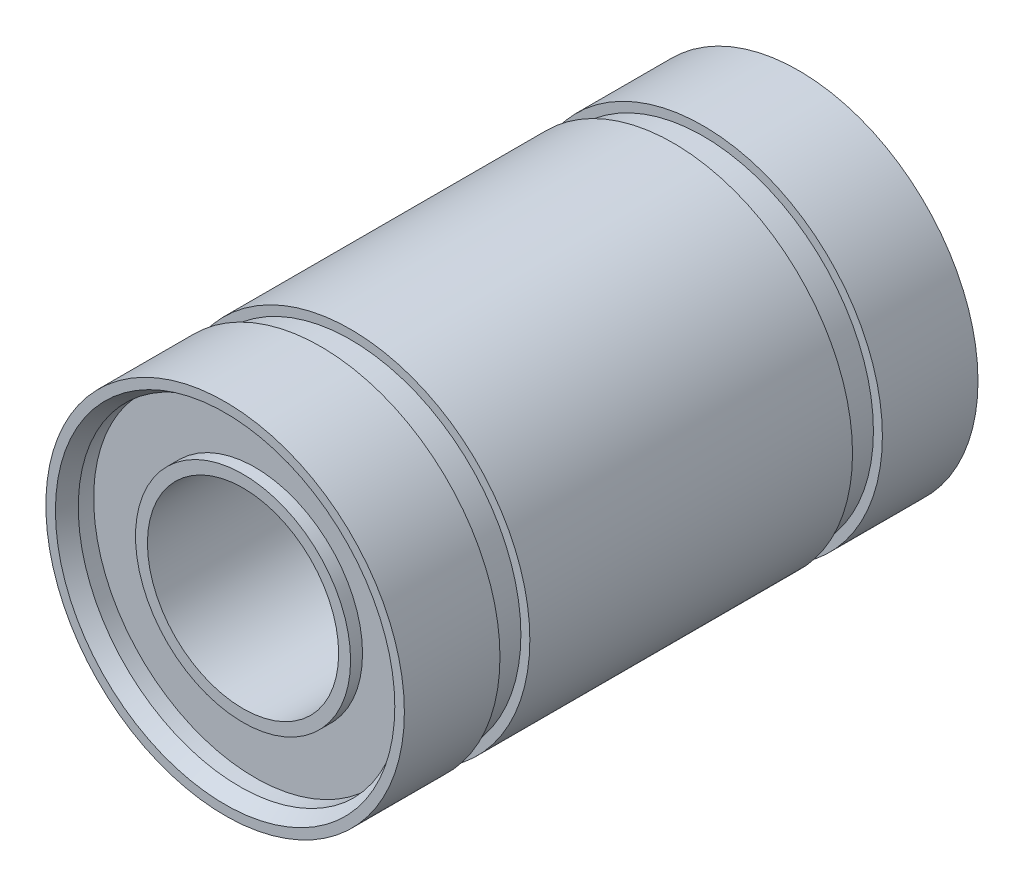
from build123d import *

# Parameters (mm, degrees)
SZKIC1_R                    = 7.5
SZKIC1_R_2                  = 4
DODANIE_WYCI_GNI_CIE1_DEPTH = 12
SZKIC2_R                    = 6.75
WYTNIJ_WYCI_GNI_CIE1_DEPTH  = 1.25
SZKIC3_R                    = 4.5
SZKIC3_R_2                  = 4
DODANIE_WYCI_GNI_CIE2_DEPTH = 0.5
SFAZOWANIE1_SIZE            = 0.35
SFAZOWANIE1_SIZE2           = 0.606217783
SZKIC4_R                    = 7.5
SZKIC4_R_2                  = 7.125
WYTNIJ_WYCI_GNI_CIE2_DEPTH  = 1.25
SFAZOWANIE2_SIZE            = 0.35
SFAZOWANIE2_SIZE2           = 0.606217783


with BuildPart() as part:
    # Szkic1 → Dodanie-wyciągnięcie1 (new, symmetric)
    with BuildSketch(Plane.XY):
        Circle(SZKIC1_R)
        Circle(SZKIC1_R_2, mode=Mode.SUBTRACT)
    extrude(amount=DODANIE_WYCI_GNI_CIE1_DEPTH, both=True)

    # Szkic2 → Wytnij-wyciągnięcie1 (cut)
    with BuildSketch(Plane.XY.offset(12)):
        Circle(SZKIC2_R)
    wytnij_wyci_gni_cie1 = extrude(amount=-WYTNIJ_WYCI_GNI_CIE1_DEPTH, mode=Mode.SUBTRACT)

    # Szkic3 → Dodanie-wyciągnięcie2 (add)
    with BuildSketch(Plane.XY.offset(10.75)):
        Circle(SZKIC3_R)
        Circle(SZKIC3_R_2, mode=Mode.SUBTRACT)
    dodanie_wyci_gni_cie2 = extrude(amount=DODANIE_WYCI_GNI_CIE2_DEPTH)

    # Sfazowanie1
    sfazowanie1_edges = [part.edges().sort_by_distance(p)[0] for p in [
        (-6.75, 0, 12),
    ]]
    sfazowanie1_side = [part.faces().sort_by_distance(p)[0] for p in [
        (-7.287867966, 0, 12),
    ]]
    chamfer(sfazowanie1_edges, length=SFAZOWANIE1_SIZE, length2=SFAZOWANIE1_SIZE2, reference=sfazowanie1_side[0])

    # Szkic4 → Wytnij-wyciągnięcie2 (cut)
    with BuildSketch(Plane.XY.offset(8)):
        Circle(SZKIC4_R)
        Circle(SZKIC4_R_2, mode=Mode.SUBTRACT)
    wytnij_wyci_gni_cie2 = extrude(amount=-WYTNIJ_WYCI_GNI_CIE2_DEPTH, mode=Mode.SUBTRACT)

    # Lustro4: Wytnij-wyciągnięcie1, Dodanie-wyciągnięcie2, Wytnij-wyciągnięcie2 across plane
    add(wytnij_wyci_gni_cie1.mirror(Plane.XY), mode=Mode.SUBTRACT)
    add(dodanie_wyci_gni_cie2.mirror(Plane.XY))
    add(wytnij_wyci_gni_cie2.mirror(Plane.XY), mode=Mode.SUBTRACT)

    # Sfazowanie2
    sfazowanie2_edges = [part.edges().sort_by_distance(p)[0] for p in [
        (-6.75, 0, -12),
    ]]
    sfazowanie2_side = [part.faces().sort_by_distance(p)[0] for p in [
        (-7.287867966, 0, -12),
    ]]
    chamfer(sfazowanie2_edges, length=SFAZOWANIE2_SIZE, length2=SFAZOWANIE2_SIZE2, reference=sfazowanie2_side[0])


solid = part.part
